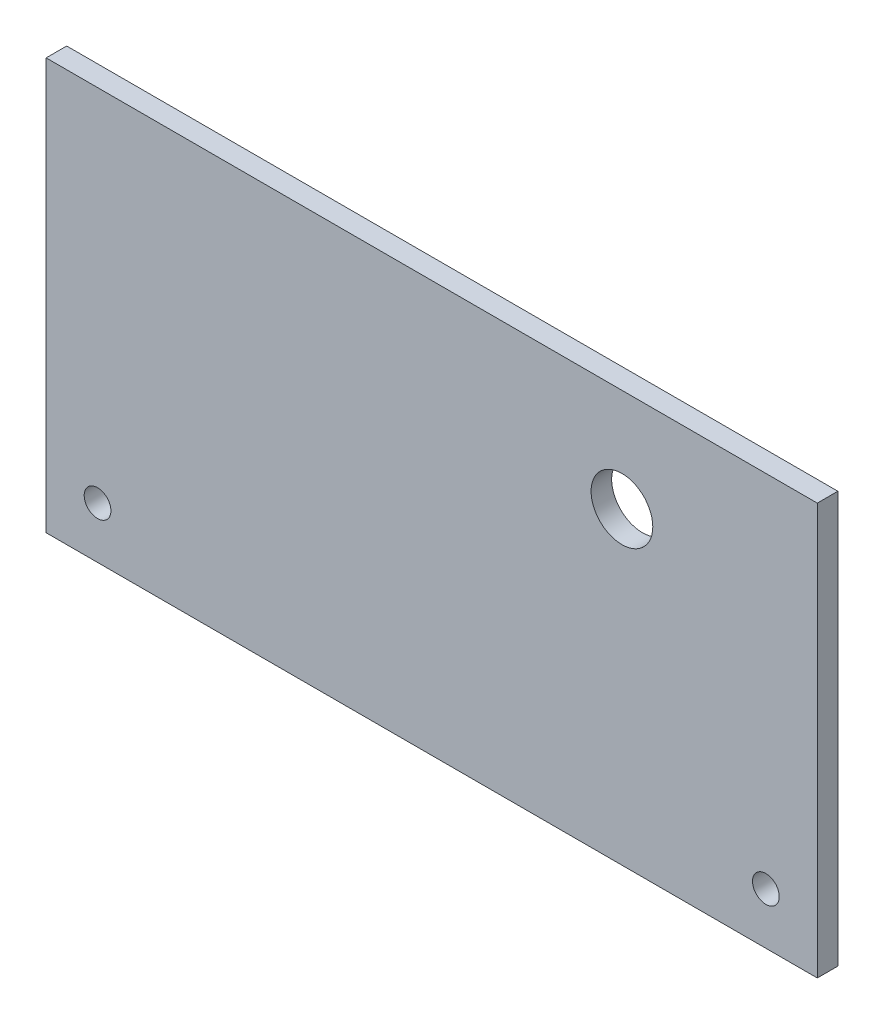
from build123d import *

# Parameters (mm, degrees)
SKETCH_1_W               = 150
SKETCH_1_H               = 80
EXTRUDE_1_DEPTH          = 4
CUT_EXTRUDE_2_DEPTH      = 12
CUT_EXTRUDE_2_DEPTH_BACK = 27
SKETCH_2_R               = 6
SKETCH_2_R_2             = 2.6


with BuildPart() as part:
    # 草图1 → 凸台-拉伸1 (new body)
    with BuildSketch(Plane.XY):
        with Locations((11.84459115, -3.937887846)):
            Rectangle(SKETCH_1_W, SKETCH_1_H)
    extrude(amount=EXTRUDE_1_DEPTH)

    # 草图2 → 切除-拉伸2 (cut, two sides: drawn at the far end of the back side and taken through both)
    with BuildSketch(Plane.XY.offset(4).offset(-CUT_EXTRUDE_2_DEPTH_BACK)):
        with Locations((48.84459115, 16.062112154)):
            Circle(SKETCH_2_R)
        with Locations((-53.15540885, -33.937887846)):
            Circle(SKETCH_2_R_2)
        with Locations((76.84459115, -33.937887846)):
            Circle(SKETCH_2_R_2)
    extrude(amount=CUT_EXTRUDE_2_DEPTH + CUT_EXTRUDE_2_DEPTH_BACK, mode=Mode.SUBTRACT)


solid = part.part
